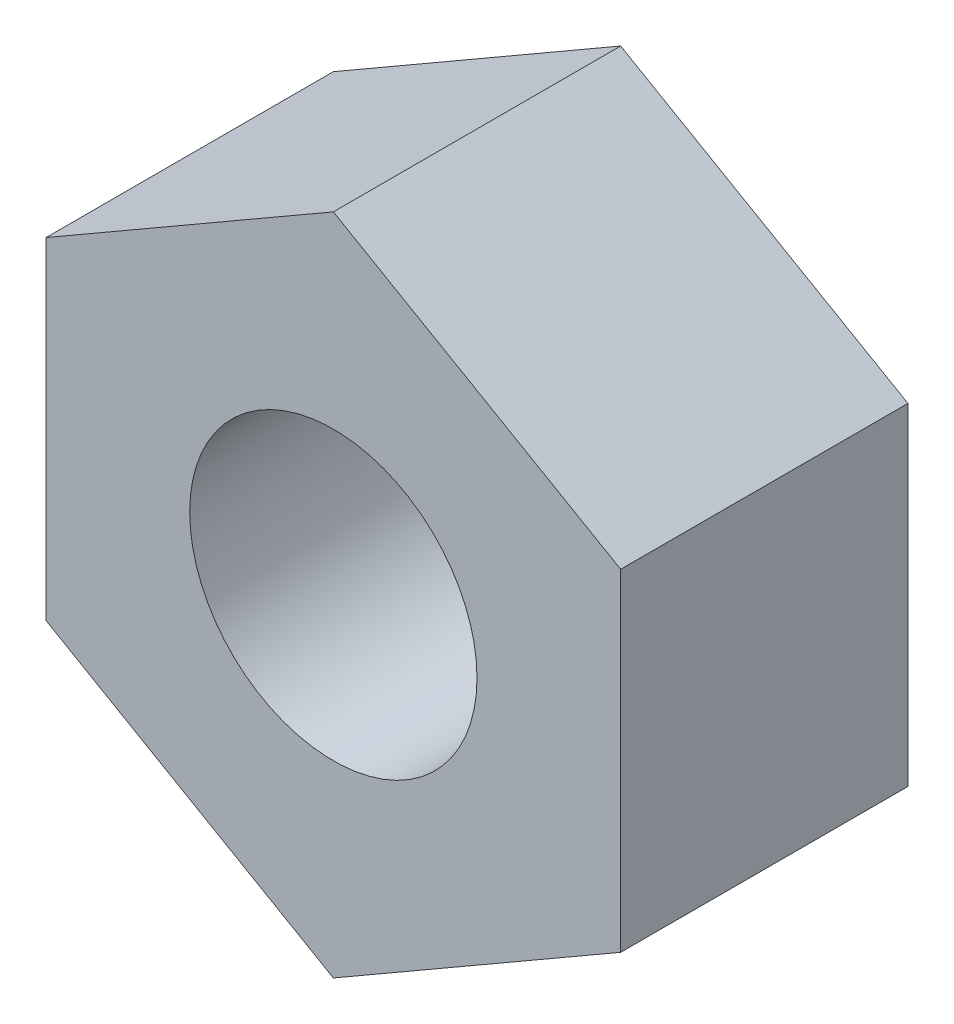
from build123d import *

# Parameters (mm, degrees)
SKETCH_1_R      = 1.5
EXTRUDE_1_DEPTH = 3


with BuildPart() as part:
    # 草图1 → 凸台-拉伸1 (new body)
    with BuildSketch(Plane.XY):
        Polygon((0, 3.464101615), (-3, 1.732050808), (-3, -1.732050808), (0, -3.464101615), (3, -1.732050808), (3, 1.732050808), align=None)
        Circle(SKETCH_1_R, mode=Mode.SUBTRACT)
    extrude(amount=EXTRUDE_1_DEPTH)


solid = part.part
